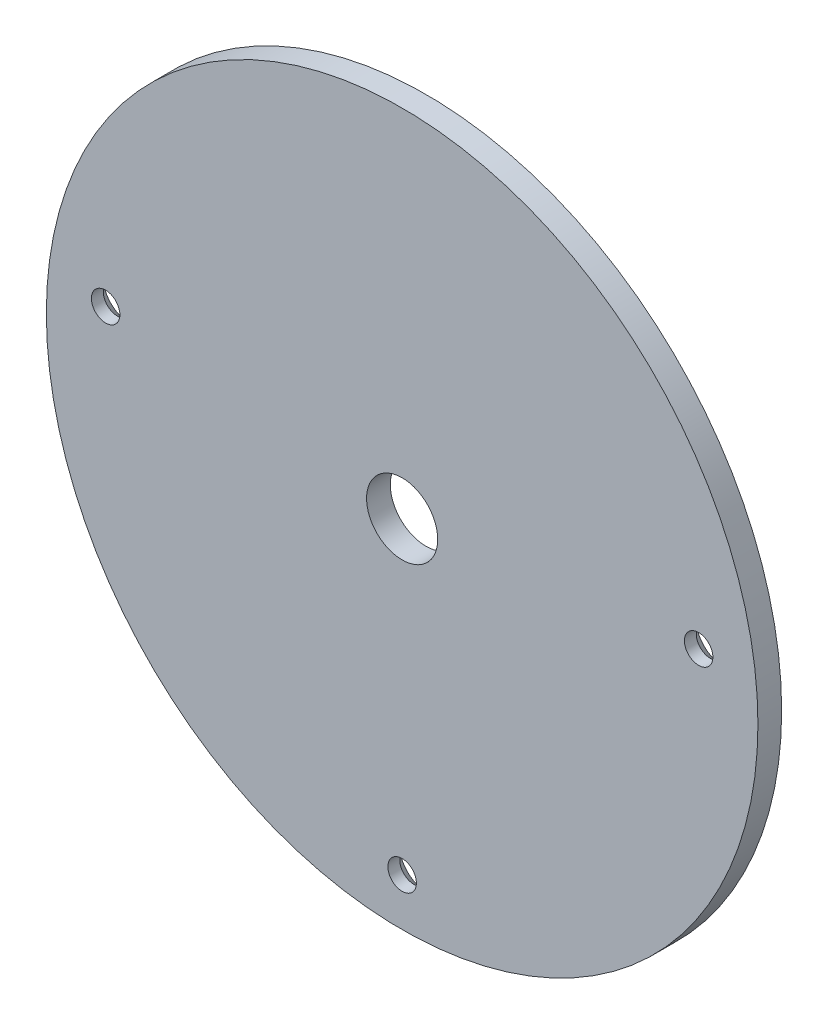
from build123d import *

# Parameters (mm, degrees)
SCHIZZO1_R                             = 30
SCHIZZO1_R_2                           = 3
ESTRUSIONE_ESTRUSIONE1_DEPTH           = 2
FORO_SVASATO_PER_VITE_M2_1_D           = 2.4
FORO_SVASATO_PER_VITE_M2_1_DEPTH       = 6
FORO_SVASATO_PER_VITE_M2_1_CSINK_D     = 4.4
FORO_SVASATO_PER_VITE_M2_1_CSINK_ANGLE = 90
FORO_SVASATO_PER_VITE_M2_1_TIP         = 0.721032743


with BuildPart() as part:
    # Schizzo1 → Estrusione-Estrusione1 (new body)
    with BuildSketch(Plane.XY):
        Circle(SCHIZZO1_R)
        Circle(SCHIZZO1_R_2, mode=Mode.SUBTRACT)
    extrude(amount=ESTRUSIONE_ESTRUSIONE1_DEPTH)

    # Foro svasato per Vite M2-1
    with Locations(Plane(origin=(0, 0, 0), x_dir=(-1, 0, 0), z_dir=(0, 0, -1))):
        with Locations((0, -26), (-25, 3), (25, 3)):
            CounterSinkHole(FORO_SVASATO_PER_VITE_M2_1_D / 2, FORO_SVASATO_PER_VITE_M2_1_CSINK_D / 2, depth=FORO_SVASATO_PER_VITE_M2_1_DEPTH, counter_sink_angle=FORO_SVASATO_PER_VITE_M2_1_CSINK_ANGLE)
            with Locations((0, 0, -(FORO_SVASATO_PER_VITE_M2_1_DEPTH + FORO_SVASATO_PER_VITE_M2_1_TIP / 2))):  # 118° drill point
                Cone(0, FORO_SVASATO_PER_VITE_M2_1_D / 2, FORO_SVASATO_PER_VITE_M2_1_TIP, mode=Mode.SUBTRACT)


solid = part.part
